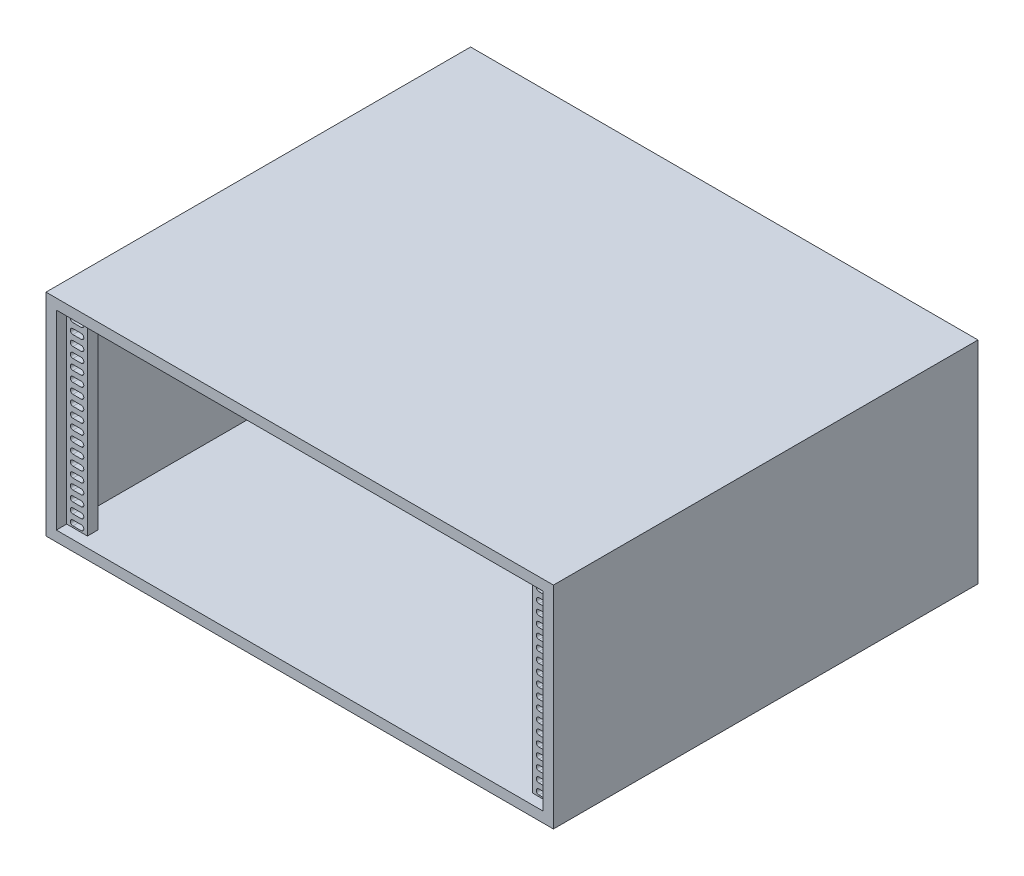
from build123d import *

# Parameters (mm, degrees)
SKETCH1_W             = 490
SKETCH1_H             = 204
SKETCH1_W_2           = 470
SKETCH1_H_2           = 184
BOSS_EXTRUDE1_DEPTH   = 410
BOSS_EXTRUDE2_START   = -20
SKETCH2_W             = 20
SKETCH2_H             = 184
BOSS_EXTRUDE2_DEPTH   = 10
CUT_EXTRUDE1_REACH    = 482.03
LPATTERN1_COUNT       = 18
LPATTERN1_PITCH       = 10
MIRROR1_COPY_1_REACH  = 482.03
MIRROR1_COPY_2_REACH  = 482.03
MIRROR1_COPY_3_REACH  = 482.03
MIRROR1_COPY_4_REACH  = 482.03
MIRROR1_COPY_5_REACH  = 482.03
MIRROR1_COPY_6_REACH  = 482.03
MIRROR1_COPY_7_REACH  = 482.03
MIRROR1_COPY_8_REACH  = 482.03
MIRROR1_COPY_9_REACH  = 482.03
MIRROR1_COPY_10_REACH = 482.03
MIRROR1_COPY_11_REACH = 482.03
MIRROR1_COPY_12_REACH = 482.03
MIRROR1_COPY_13_REACH = 482.03
MIRROR1_COPY_14_REACH = 482.03
MIRROR1_COPY_15_REACH = 482.03
MIRROR1_COPY_16_REACH = 482.03
MIRROR1_COPY_17_REACH = 482.03


with BuildPart() as part:
    # Sketch1 → Boss-Extrude1 (new body)
    with BuildSketch(Plane.XY):
        Rectangle(SKETCH1_W, SKETCH1_H)
        Rectangle(SKETCH1_W_2, SKETCH1_H_2, mode=Mode.SUBTRACT)
    extrude(amount=-BOSS_EXTRUDE1_DEPTH)

    # Sketch2 → Boss-Extrude2 (add)
    with BuildSketch(Plane.XY.offset(BOSS_EXTRUDE2_START)):
        with Locations((-225, 0)):
            Rectangle(SKETCH2_W, SKETCH2_H)
    boss_extrude2 = extrude(amount=BOSS_EXTRUDE2_DEPTH)

    # Sketch3 → Cut-Extrude1 (cut, up to next)
    with BuildSketch(Plane.XY.offset(-10), mode=Mode.PRIVATE) as cut_extrude1_sk1:
        with BuildLine():
            Line((-229, 84.5), (-221, 84.5))
            ThreePointArc((-221, 84.5), (-218.5, 82), (-221, 79.5))
            Line((-221, 79.5), (-229, 79.5))
            ThreePointArc((-229, 79.5), (-231.5, 82), (-229, 84.5))
        make_face()
    cut_extrude1_tool1 = extrude(cut_extrude1_sk1.sketch, amount=-CUT_EXTRUDE1_REACH, mode=Mode.PRIVATE) & part.part
    cut_extrude1 = cut_extrude1_tool1.solids().sort_by_distance((-225, 82, -10))[0]
    add(cut_extrude1, mode=Mode.SUBTRACT)

    # LPattern1: Cut-Extrude1 ×18
    with Locations(*[(0, -i * LPATTERN1_PITCH, 0) for i in range(1, LPATTERN1_COUNT)]):
        add(cut_extrude1, mode=Mode.SUBTRACT)

    # Mirror1: Boss-Extrude2, Cut-Extrude1 across plane
    add(boss_extrude2.mirror(Plane(origin=(0, 0, 0), x_dir=(0, 0, 1), z_dir=(1, 0, 0))))
    add(cut_extrude1.mirror(Plane(origin=(0, 0, 0), x_dir=(0, 0, 1), z_dir=(1, 0, 0))), mode=Mode.SUBTRACT)

    # Mirror1 copy 1 sketch → Mirror1 copy 1 (cut, up to next)
    with BuildSketch(Plane(origin=(0, -10, -10), x_dir=(-1, 0, 0), z_dir=(0, 0, 1)), mode=Mode.PRIVATE) as mirror1_copy_1_sk1:
        with BuildLine():
            Line((-229, -84.5), (-221, -84.5))
            ThreePointArc((-221, -84.5), (-218.5, -82), (-221, -79.5))
            Line((-221, -79.5), (-229, -79.5))
            ThreePointArc((-229, -79.5), (-231.5, -82), (-229, -84.5))
        make_face()
    mirror1_copy_1_tool1 = extrude(mirror1_copy_1_sk1.sketch, amount=-MIRROR1_COPY_1_REACH, mode=Mode.PRIVATE) & part.part
    add(mirror1_copy_1_tool1.solids().sort_by_distance((225, 72, -10))[0], mode=Mode.SUBTRACT)

    # Mirror1 copy 2 sketch → Mirror1 copy 2 (cut, up to next)
    with BuildSketch(Plane(origin=(0, -20, -10), x_dir=(-1, 0, 0), z_dir=(0, 0, 1)), mode=Mode.PRIVATE) as mirror1_copy_2_sk1:
        with BuildLine():
            Line((-229, -84.5), (-221, -84.5))
            ThreePointArc((-221, -84.5), (-218.5, -82), (-221, -79.5))
            Line((-221, -79.5), (-229, -79.5))
            ThreePointArc((-229, -79.5), (-231.5, -82), (-229, -84.5))
        make_face()
    mirror1_copy_2_tool1 = extrude(mirror1_copy_2_sk1.sketch, amount=-MIRROR1_COPY_2_REACH, mode=Mode.PRIVATE) & part.part
    add(mirror1_copy_2_tool1.solids().sort_by_distance((225, 62, -10))[0], mode=Mode.SUBTRACT)

    # Mirror1 copy 3 sketch → Mirror1 copy 3 (cut, up to next)
    with BuildSketch(Plane(origin=(0, -30, -10), x_dir=(-1, 0, 0), z_dir=(0, 0, 1)), mode=Mode.PRIVATE) as mirror1_copy_3_sk1:
        with BuildLine():
            Line((-229, -84.5), (-221, -84.5))
            ThreePointArc((-221, -84.5), (-218.5, -82), (-221, -79.5))
            Line((-221, -79.5), (-229, -79.5))
            ThreePointArc((-229, -79.5), (-231.5, -82), (-229, -84.5))
        make_face()
    mirror1_copy_3_tool1 = extrude(mirror1_copy_3_sk1.sketch, amount=-MIRROR1_COPY_3_REACH, mode=Mode.PRIVATE) & part.part
    add(mirror1_copy_3_tool1.solids().sort_by_distance((225, 52, -10))[0], mode=Mode.SUBTRACT)

    # Mirror1 copy 4 sketch → Mirror1 copy 4 (cut, up to next)
    with BuildSketch(Plane(origin=(0, -40, -10), x_dir=(-1, 0, 0), z_dir=(0, 0, 1)), mode=Mode.PRIVATE) as mirror1_copy_4_sk1:
        with BuildLine():
            Line((-229, -84.5), (-221, -84.5))
            ThreePointArc((-221, -84.5), (-218.5, -82), (-221, -79.5))
            Line((-221, -79.5), (-229, -79.5))
            ThreePointArc((-229, -79.5), (-231.5, -82), (-229, -84.5))
        make_face()
    mirror1_copy_4_tool1 = extrude(mirror1_copy_4_sk1.sketch, amount=-MIRROR1_COPY_4_REACH, mode=Mode.PRIVATE) & part.part
    add(mirror1_copy_4_tool1.solids().sort_by_distance((225, 42, -10))[0], mode=Mode.SUBTRACT)

    # Mirror1 copy 5 sketch → Mirror1 copy 5 (cut, up to next)
    with BuildSketch(Plane(origin=(0, -50, -10), x_dir=(-1, 0, 0), z_dir=(0, 0, 1)), mode=Mode.PRIVATE) as mirror1_copy_5_sk1:
        with BuildLine():
            Line((-229, -84.5), (-221, -84.5))
            ThreePointArc((-221, -84.5), (-218.5, -82), (-221, -79.5))
            Line((-221, -79.5), (-229, -79.5))
            ThreePointArc((-229, -79.5), (-231.5, -82), (-229, -84.5))
        make_face()
    mirror1_copy_5_tool1 = extrude(mirror1_copy_5_sk1.sketch, amount=-MIRROR1_COPY_5_REACH, mode=Mode.PRIVATE) & part.part
    add(mirror1_copy_5_tool1.solids().sort_by_distance((225, 32, -10))[0], mode=Mode.SUBTRACT)

    # Mirror1 copy 6 sketch → Mirror1 copy 6 (cut, up to next)
    with BuildSketch(Plane(origin=(0, -60, -10), x_dir=(-1, 0, 0), z_dir=(0, 0, 1)), mode=Mode.PRIVATE) as mirror1_copy_6_sk1:
        with BuildLine():
            Line((-229, -84.5), (-221, -84.5))
            ThreePointArc((-221, -84.5), (-218.5, -82), (-221, -79.5))
            Line((-221, -79.5), (-229, -79.5))
            ThreePointArc((-229, -79.5), (-231.5, -82), (-229, -84.5))
        make_face()
    mirror1_copy_6_tool1 = extrude(mirror1_copy_6_sk1.sketch, amount=-MIRROR1_COPY_6_REACH, mode=Mode.PRIVATE) & part.part
    add(mirror1_copy_6_tool1.solids().sort_by_distance((225, 22, -10))[0], mode=Mode.SUBTRACT)

    # Mirror1 copy 7 sketch → Mirror1 copy 7 (cut, up to next)
    with BuildSketch(Plane(origin=(0, -70, -10), x_dir=(-1, 0, 0), z_dir=(0, 0, 1)), mode=Mode.PRIVATE) as mirror1_copy_7_sk1:
        with BuildLine():
            Line((-229, -84.5), (-221, -84.5))
            ThreePointArc((-221, -84.5), (-218.5, -82), (-221, -79.5))
            Line((-221, -79.5), (-229, -79.5))
            ThreePointArc((-229, -79.5), (-231.5, -82), (-229, -84.5))
        make_face()
    mirror1_copy_7_tool1 = extrude(mirror1_copy_7_sk1.sketch, amount=-MIRROR1_COPY_7_REACH, mode=Mode.PRIVATE) & part.part
    add(mirror1_copy_7_tool1.solids().sort_by_distance((225, 12, -10))[0], mode=Mode.SUBTRACT)

    # Mirror1 copy 8 sketch → Mirror1 copy 8 (cut, up to next)
    with BuildSketch(Plane(origin=(0, -80, -10), x_dir=(-1, 0, 0), z_dir=(0, 0, 1)), mode=Mode.PRIVATE) as mirror1_copy_8_sk1:
        with BuildLine():
            Line((-229, -84.5), (-221, -84.5))
            ThreePointArc((-221, -84.5), (-218.5, -82), (-221, -79.5))
            Line((-221, -79.5), (-229, -79.5))
            ThreePointArc((-229, -79.5), (-231.5, -82), (-229, -84.5))
        make_face()
    mirror1_copy_8_tool1 = extrude(mirror1_copy_8_sk1.sketch, amount=-MIRROR1_COPY_8_REACH, mode=Mode.PRIVATE) & part.part
    add(mirror1_copy_8_tool1.solids().sort_by_distance((225, 2, -10))[0], mode=Mode.SUBTRACT)

    # Mirror1 copy 9 sketch → Mirror1 copy 9 (cut, up to next)
    with BuildSketch(Plane(origin=(0, -90, -10), x_dir=(-1, 0, 0), z_dir=(0, 0, 1)), mode=Mode.PRIVATE) as mirror1_copy_9_sk1:
        with BuildLine():
            Line((-229, -84.5), (-221, -84.5))
            ThreePointArc((-221, -84.5), (-218.5, -82), (-221, -79.5))
            Line((-221, -79.5), (-229, -79.5))
            ThreePointArc((-229, -79.5), (-231.5, -82), (-229, -84.5))
        make_face()
    mirror1_copy_9_tool1 = extrude(mirror1_copy_9_sk1.sketch, amount=-MIRROR1_COPY_9_REACH, mode=Mode.PRIVATE) & part.part
    add(mirror1_copy_9_tool1.solids().sort_by_distance((225, -8, -10))[0], mode=Mode.SUBTRACT)

    # Mirror1 copy 10 sketch → Mirror1 copy 10 (cut, up to next)
    with BuildSketch(Plane(origin=(0, -100, -10), x_dir=(-1, 0, 0), z_dir=(0, 0, 1)), mode=Mode.PRIVATE) as mirror1_copy_10_sk1:
        with BuildLine():
            Line((-229, -84.5), (-221, -84.5))
            ThreePointArc((-221, -84.5), (-218.5, -82), (-221, -79.5))
            Line((-221, -79.5), (-229, -79.5))
            ThreePointArc((-229, -79.5), (-231.5, -82), (-229, -84.5))
        make_face()
    mirror1_copy_10_tool1 = extrude(mirror1_copy_10_sk1.sketch, amount=-MIRROR1_COPY_10_REACH, mode=Mode.PRIVATE) & part.part
    add(mirror1_copy_10_tool1.solids().sort_by_distance((225, -18, -10))[0], mode=Mode.SUBTRACT)

    # Mirror1 copy 11 sketch → Mirror1 copy 11 (cut, up to next)
    with BuildSketch(Plane(origin=(0, -110, -10), x_dir=(-1, 0, 0), z_dir=(0, 0, 1)), mode=Mode.PRIVATE) as mirror1_copy_11_sk1:
        with BuildLine():
            Line((-229, -84.5), (-221, -84.5))
            ThreePointArc((-221, -84.5), (-218.5, -82), (-221, -79.5))
            Line((-221, -79.5), (-229, -79.5))
            ThreePointArc((-229, -79.5), (-231.5, -82), (-229, -84.5))
        make_face()
    mirror1_copy_11_tool1 = extrude(mirror1_copy_11_sk1.sketch, amount=-MIRROR1_COPY_11_REACH, mode=Mode.PRIVATE) & part.part
    add(mirror1_copy_11_tool1.solids().sort_by_distance((225, -28, -10))[0], mode=Mode.SUBTRACT)

    # Mirror1 copy 12 sketch → Mirror1 copy 12 (cut, up to next)
    with BuildSketch(Plane(origin=(0, -120, -10), x_dir=(-1, 0, 0), z_dir=(0, 0, 1)), mode=Mode.PRIVATE) as mirror1_copy_12_sk1:
        with BuildLine():
            Line((-229, -84.5), (-221, -84.5))
            ThreePointArc((-221, -84.5), (-218.5, -82), (-221, -79.5))
            Line((-221, -79.5), (-229, -79.5))
            ThreePointArc((-229, -79.5), (-231.5, -82), (-229, -84.5))
        make_face()
    mirror1_copy_12_tool1 = extrude(mirror1_copy_12_sk1.sketch, amount=-MIRROR1_COPY_12_REACH, mode=Mode.PRIVATE) & part.part
    add(mirror1_copy_12_tool1.solids().sort_by_distance((225, -38, -10))[0], mode=Mode.SUBTRACT)

    # Mirror1 copy 13 sketch → Mirror1 copy 13 (cut, up to next)
    with BuildSketch(Plane(origin=(0, -130, -10), x_dir=(-1, 0, 0), z_dir=(0, 0, 1)), mode=Mode.PRIVATE) as mirror1_copy_13_sk1:
        with BuildLine():
            Line((-229, -84.5), (-221, -84.5))
            ThreePointArc((-221, -84.5), (-218.5, -82), (-221, -79.5))
            Line((-221, -79.5), (-229, -79.5))
            ThreePointArc((-229, -79.5), (-231.5, -82), (-229, -84.5))
        make_face()
    mirror1_copy_13_tool1 = extrude(mirror1_copy_13_sk1.sketch, amount=-MIRROR1_COPY_13_REACH, mode=Mode.PRIVATE) & part.part
    add(mirror1_copy_13_tool1.solids().sort_by_distance((225, -48, -10))[0], mode=Mode.SUBTRACT)

    # Mirror1 copy 14 sketch → Mirror1 copy 14 (cut, up to next)
    with BuildSketch(Plane(origin=(0, -140, -10), x_dir=(-1, 0, 0), z_dir=(0, 0, 1)), mode=Mode.PRIVATE) as mirror1_copy_14_sk1:
        with BuildLine():
            Line((-229, -84.5), (-221, -84.5))
            ThreePointArc((-221, -84.5), (-218.5, -82), (-221, -79.5))
            Line((-221, -79.5), (-229, -79.5))
            ThreePointArc((-229, -79.5), (-231.5, -82), (-229, -84.5))
        make_face()
    mirror1_copy_14_tool1 = extrude(mirror1_copy_14_sk1.sketch, amount=-MIRROR1_COPY_14_REACH, mode=Mode.PRIVATE) & part.part
    add(mirror1_copy_14_tool1.solids().sort_by_distance((225, -58, -10))[0], mode=Mode.SUBTRACT)

    # Mirror1 copy 15 sketch → Mirror1 copy 15 (cut, up to next)
    with BuildSketch(Plane(origin=(0, -150, -10), x_dir=(-1, 0, 0), z_dir=(0, 0, 1)), mode=Mode.PRIVATE) as mirror1_copy_15_sk1:
        with BuildLine():
            Line((-229, -84.5), (-221, -84.5))
            ThreePointArc((-221, -84.5), (-218.5, -82), (-221, -79.5))
            Line((-221, -79.5), (-229, -79.5))
            ThreePointArc((-229, -79.5), (-231.5, -82), (-229, -84.5))
        make_face()
    mirror1_copy_15_tool1 = extrude(mirror1_copy_15_sk1.sketch, amount=-MIRROR1_COPY_15_REACH, mode=Mode.PRIVATE) & part.part
    add(mirror1_copy_15_tool1.solids().sort_by_distance((225, -68, -10))[0], mode=Mode.SUBTRACT)

    # Mirror1 copy 16 sketch → Mirror1 copy 16 (cut, up to next)
    with BuildSketch(Plane(origin=(0, -160, -10), x_dir=(-1, 0, 0), z_dir=(0, 0, 1)), mode=Mode.PRIVATE) as mirror1_copy_16_sk1:
        with BuildLine():
            Line((-229, -84.5), (-221, -84.5))
            ThreePointArc((-221, -84.5), (-218.5, -82), (-221, -79.5))
            Line((-221, -79.5), (-229, -79.5))
            ThreePointArc((-229, -79.5), (-231.5, -82), (-229, -84.5))
        make_face()
    mirror1_copy_16_tool1 = extrude(mirror1_copy_16_sk1.sketch, amount=-MIRROR1_COPY_16_REACH, mode=Mode.PRIVATE) & part.part
    add(mirror1_copy_16_tool1.solids().sort_by_distance((225, -78, -10))[0], mode=Mode.SUBTRACT)

    # Mirror1 copy 17 sketch → Mirror1 copy 17 (cut, up to next)
    with BuildSketch(Plane(origin=(0, -170, -10), x_dir=(-1, 0, 0), z_dir=(0, 0, 1)), mode=Mode.PRIVATE) as mirror1_copy_17_sk1:
        with BuildLine():
            Line((-229, -84.5), (-221, -84.5))
            ThreePointArc((-221, -84.5), (-218.5, -82), (-221, -79.5))
            Line((-221, -79.5), (-229, -79.5))
            ThreePointArc((-229, -79.5), (-231.5, -82), (-229, -84.5))
        make_face()
    mirror1_copy_17_tool1 = extrude(mirror1_copy_17_sk1.sketch, amount=-MIRROR1_COPY_17_REACH, mode=Mode.PRIVATE) & part.part
    add(mirror1_copy_17_tool1.solids().sort_by_distance((225, -88, -10))[0], mode=Mode.SUBTRACT)


solid = part.part
